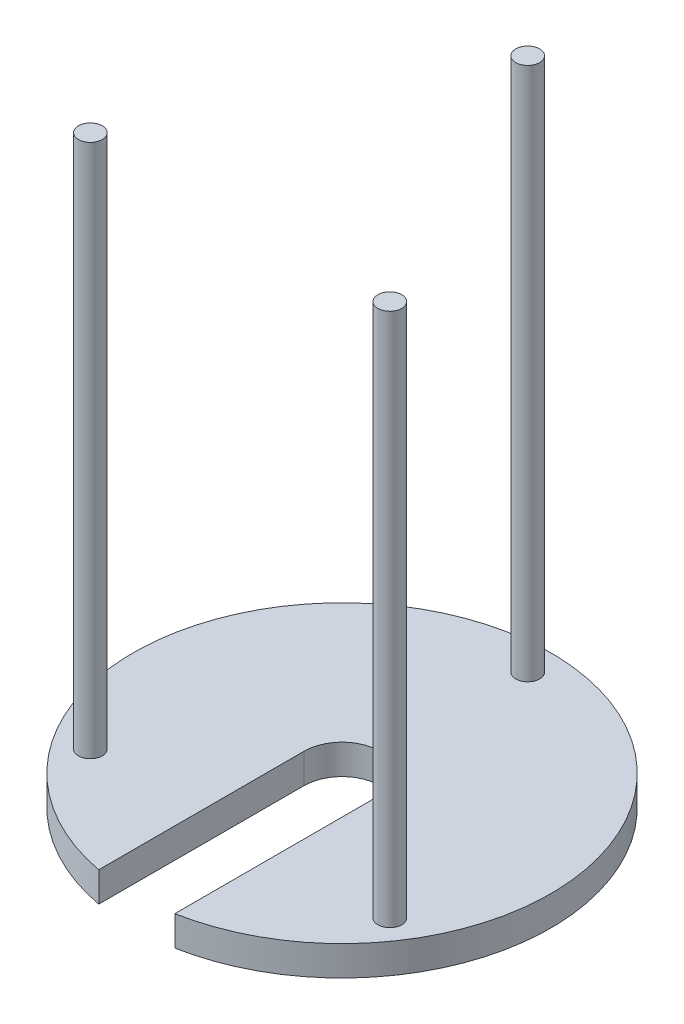
from build123d import *

# Parameters (mm, degrees)
SKETCH_1_R          = 70
EXTRUDE_1_DEPTH     = 10
SKETCH_2_R          = 4
EXTRUDE_4_DEPTH     = 179
SKETCH_5_R          = 12.75
SKETCH_5_W          = 25.5
SKETCH_5_H          = 74.344778921
CUT_EXTRUDE_1_DEPTH = 10


with BuildPart() as part:
    # 草图1 → 凸台-拉伸1 (new body)
    with BuildSketch(Plane(origin=(0, 0, 0), x_dir=(1, 0, 0), z_dir=(0, 1, 0))):
        with Locations(Location((0, 0, 0), (0, 0, 270))):
            Circle(SKETCH_1_R)
    extrude(amount=EXTRUDE_1_DEPTH)

    # 草图2 → 凸台-拉伸4 (add)
    with BuildSketch(Plane(origin=(0, 10, 0), x_dir=(1, 0, 0), z_dir=(0, 1, 0))):
        with Locations(Location((-49.22649816, -35.171037501, 0), (0, 0, 90))):
            Circle(SKETCH_2_R)
        with Locations(Location((1.767528256, 60.5, 0), (0, 0, 90))):
            Circle(SKETCH_2_R)
        with Locations(Location((50.035340598, -34.010508542, 0), (0, 0, 90))):
            Circle(SKETCH_2_R)
    extrude(amount=EXTRUDE_4_DEPTH)

    # 草图5 → 切除-拉伸1 (cut)
    with BuildSketch(Plane(origin=(0, 10, 0), x_dir=(1, 0, 0), z_dir=(0, 1, 0))):
        Circle(SKETCH_5_R)
        with Locations((0, -37.17238946)):
            Rectangle(SKETCH_5_W, SKETCH_5_H)
    extrude(amount=-CUT_EXTRUDE_1_DEPTH, mode=Mode.SUBTRACT)


solid = part.part
